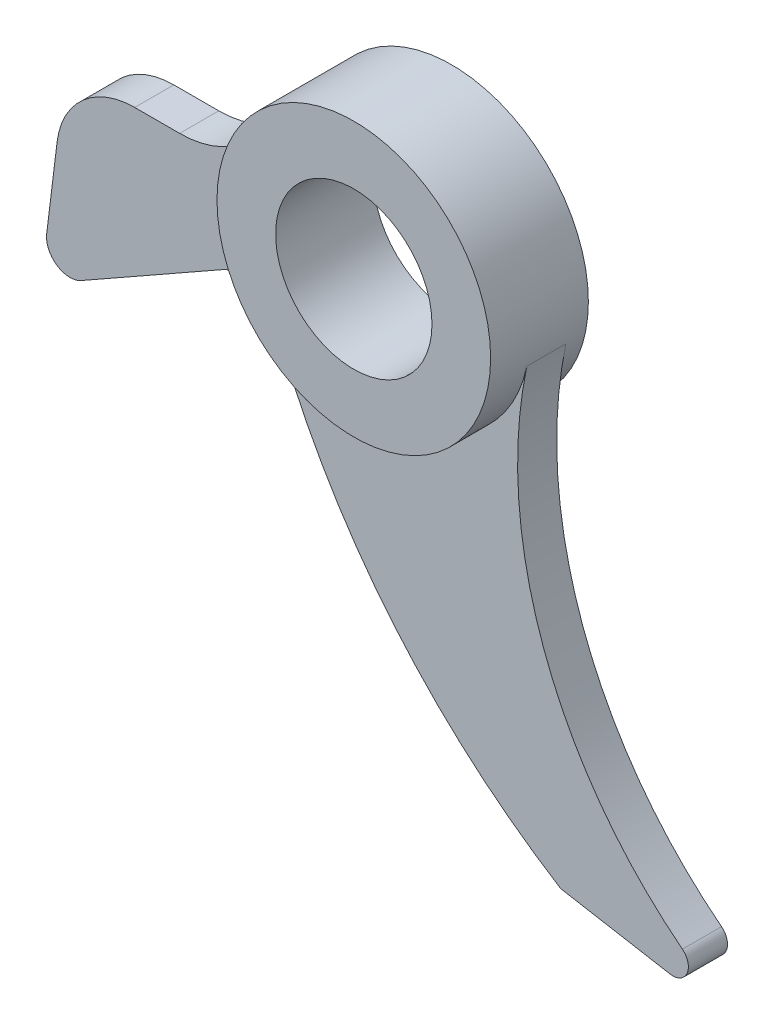
from build123d import *

# Parameters (mm, degrees)
Y_KSEKLIK_EKSTR_ZYON6_DEPTH      = 15
Y_KSEKLIK_EKSTR_ZYON6_DEPTH_BACK = 10
IZIM2_R                          = 35
IZIM2_R_2                        = 20
Y_KSEKLIK_EKSTR_ZYON7_DEPTH      = 5
Y_KSEKLIK_EKSTR_ZYON7_DEPTH_BACK = 5


with BuildPart() as part:
    # Çizim2 → Yükseklik-Ekstrüzyon6 (new, two sides: drawn at the far end of the back side and taken through both)
    with BuildSketch(Plane.XY.offset(-Y_KSEKLIK_EKSTR_ZYON6_DEPTH_BACK)):
        with Locations((27.5928394, 20.537515488)):
            Circle(IZIM2_R)
        with Locations((27.5928394, 20.537515488)):
            Circle(IZIM2_R_2, mode=Mode.SUBTRACT)
    extrude(amount=Y_KSEKLIK_EKSTR_ZYON6_DEPTH + Y_KSEKLIK_EKSTR_ZYON6_DEPTH_BACK)

    # Çizim2<9> → Yükseklik-Ekstrüzyon7 (add, two sides: drawn at the far end of the back side and taken through both)
    with BuildSketch(Plane.XY.offset(-Y_KSEKLIK_EKSTR_ZYON7_DEPTH_BACK)):
        with BuildLine():
            ThreePointArc((61.844285789, 13.337625196), (16.633425799, -12.702389047), (-4.224237601, 35.120848822))
            ThreePointArc((-4.224237601, 35.120848822), (-13.449178052, 24.4968802), (-26.950721174, 20.537515488))
            Line((-26.950721174, 20.537515488), (-38.44931098, 20.537515488))
            ThreePointArc((-38.44931098, 20.537515488), (-51.701711944, 15.516629904), (-58.300234012, 2.974902357))
            Line((-58.300234012, 2.974902357), (-60.95730449, -18.665200093))
            ThreePointArc((-60.95730449, -18.665200093), (-58.156545185, -24.500240081), (-51.684983771, -24.396138183))
            Line((-51.684983771, -24.396138183), (-15.993696643, -4.166774273))
            ThreePointArc((-15.993696643, -4.166774273), (-15.929312008, -4.130595361), (-15.864661939, -4.094892934))
            ThreePointArc((-15.864661939, -4.094892934), (-5.960873253, -4.265931617), (-1.062781275, -12.875401956))
            ThreePointArc((-1.062781275, -12.875401956), (27.996215902, -61.128273793), (70.546183821, -98.037150605))
            Line((70.546183821, -98.037150605), (98.484313975, -102.963396742))
            ThreePointArc((98.484313975, -102.963396742), (102.831933538, -100.653703951), (101.646021849, -95.875619594))
            ThreePointArc((101.646021849, -95.875619594), (66.141131912, -46.955735677), (61.844285789, 13.337625196))
        make_face()
    extrude(amount=Y_KSEKLIK_EKSTR_ZYON7_DEPTH + Y_KSEKLIK_EKSTR_ZYON7_DEPTH_BACK)


solid = part.part
